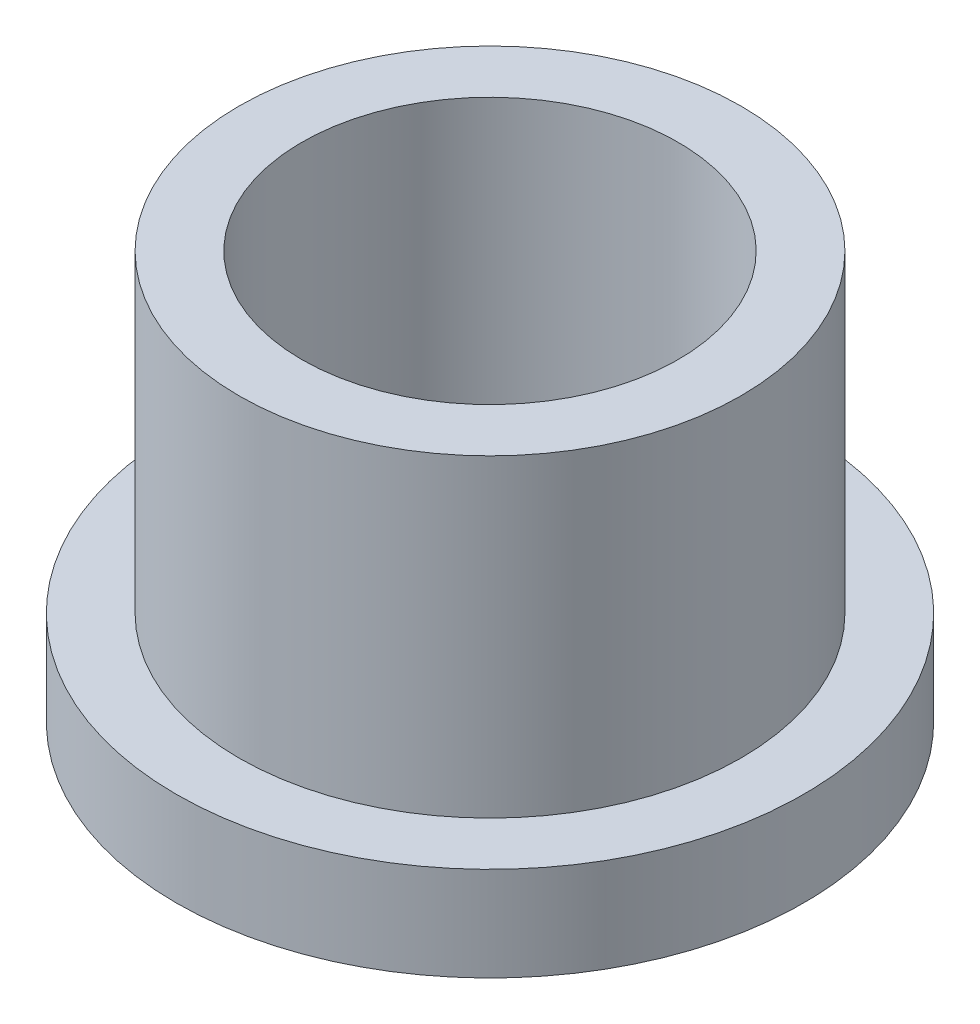
from build123d import *

# Parameters (mm, degrees)
SKETCH2_R           = 5
BOSS_EXTRUDE1_DEPTH = 1.5
SKETCH3_R           = 4
BOSS_EXTRUDE2_DEPTH = 6.5
SKETCH4_R           = 3
CUT_EXTRUDE1_DEPTH  = 10.604686356


with BuildPart() as part:
    # Sketch2 → Boss-Extrude1 (new body)
    with BuildSketch(Plane(origin=(0, 0, 0), x_dir=(1, 0, 0), z_dir=(0, 1, 0))):
        with Locations(Location((0, 0, 0), (0, 0, 270))):
            Circle(SKETCH2_R)
    extrude(amount=BOSS_EXTRUDE1_DEPTH)

    # Sketch3 → Boss-Extrude2 (add)
    with BuildSketch(Plane.XZ):
        with Locations(Location((0, 0, 0), (0, 0, 270))):
            Circle(SKETCH3_R)
    extrude(amount=-BOSS_EXTRUDE2_DEPTH)

    # Sketch4 → Cut-Extrude1 (cut, through all)
    with BuildSketch(Plane(origin=(0, 6.5, 0), x_dir=(1, 0, 0), z_dir=(0, 1, 0))):
        with Locations(Location((0, 0, 0), (0, 0, 270))):
            Circle(SKETCH4_R)
    extrude(amount=-CUT_EXTRUDE1_DEPTH, mode=Mode.SUBTRACT)


solid = part.part
